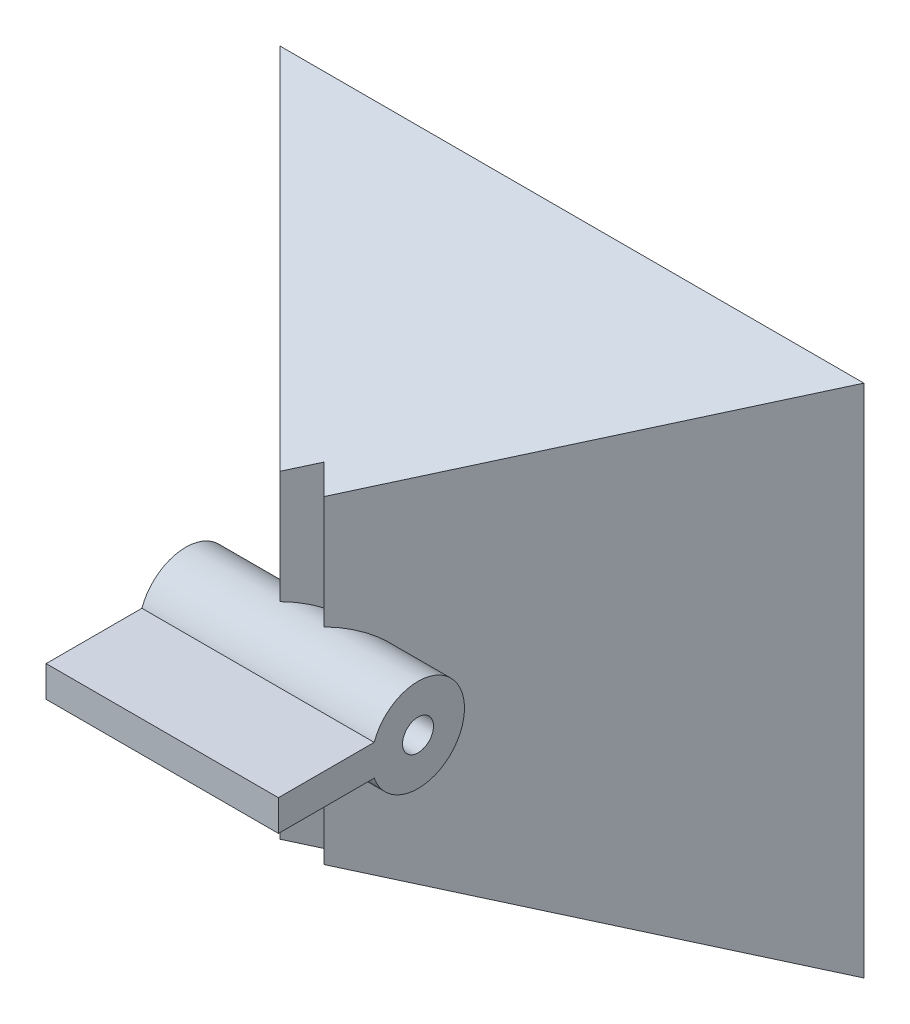
from build123d import *

# Parameters (mm, degrees)
EXTRUDE_1_DEPTH          = 200
CUT_EXTRUDE_1_DEPTH      = 222.718927326
CUT_EXTRUDE_1_DEPTH_BACK = 222.718927326
SKETCH_2_R               = 150
SKETCH_2_R_2             = 1.5
EXTRUDE_4_DEPTH          = 11.25
EXTRUDE_4_DEPTH_BACK     = 11.25
SKETCH_5_R               = 1.5
CUT_EXTRUDE_2_DEPTH      = 133.789577673
CUT_EXTRUDE_2_DEPTH_BACK = 133.789577673


with BuildPart() as part:
    # Эскиз1 → Бобышка-Вытянуть1 (new body)
    with BuildSketch(Plane(origin=(0, 0, 0), x_dir=(1, 0, 0), z_dir=(0, 1, 0))):
        Polygon((-63.065580883, 65.518470958), (69.761111645, 65.518470958), (2.121320344, -2.121320344), (0, 0), (-2.121320344, -2.121320344), (-69.761111645, 65.518470958), align=None)
    extrude(amount=EXTRUDE_1_DEPTH)

    # Эскиз2 → Вырез-Вытянуть1 (cut, two sides: drawn at the far end of the back side and taken through both)
    with BuildSketch(Plane(origin=(0, 0, 0), x_dir=(0, 0, -1), z_dir=(1, 0, 0)).offset(-CUT_EXTRUDE_1_DEPTH_BACK)):
        with Locations((-2.121320344, 100)):
            Circle(SKETCH_2_R)
        with Locations((-2.121320344, 100)):
            Circle(SKETCH_2_R_2, mode=Mode.SUBTRACT)
        Polygon((27.212959944, 126.107382569), (27.212959944, 73.892617431), (-7.080612422, 86.374456999), (-2.121320344, 100), (-7.080612422, 113.625543001), align=None, mode=Mode.SUBTRACT)
    extrude(amount=CUT_EXTRUDE_1_DEPTH + CUT_EXTRUDE_1_DEPTH_BACK, mode=Mode.SUBTRACT)

    # Эскиз5 → Бобышка-Вытянуть4 (add, two sides: drawn at the far end of the back side and taken through both)
    with BuildSketch(Plane(origin=(0, 0, 0), x_dir=(0, 0, -1), z_dir=(1, 0, 0)).offset(-EXTRUDE_4_DEPTH_BACK)):
        with BuildLine():
            ThreePointArc((-6.364433098, 98.5), (2.379124729, 100), (-6.364433098, 101.5))
            Line((-6.364433098, 101.5), (-15.643969281, 101.5))
            Line((-15.643969281, 101.5), (-15.643969281, 98.5))
            Line((-15.643969281, 98.5), (-6.364433098, 98.5))
        make_face()
        with Locations((-2.121320344, 100)):
            Circle(SKETCH_5_R, mode=Mode.SUBTRACT)
    extrude(amount=EXTRUDE_4_DEPTH + EXTRUDE_4_DEPTH_BACK)

    # Эскиз6 → Вырез-Вытянуть2 (cut, two sides: drawn at the far end of the back side and taken through both)
    with BuildSketch(Plane(origin=(0, 0, 0), x_dir=(1, 0, 0), z_dir=(0, 1, 0)).offset(-CUT_EXTRUDE_2_DEPTH_BACK)):
        Polygon((-50.182829752, 24.037490431), (0, 24.037490431), (93.439383522, 24.037490431), (93.439383522, 164.04737871), (-160.316075238, 164.04737871), (-160.316075238, 24.037490431), align=None)
    extrude(amount=CUT_EXTRUDE_2_DEPTH + CUT_EXTRUDE_2_DEPTH_BACK, mode=Mode.SUBTRACT)


solid = part.part
